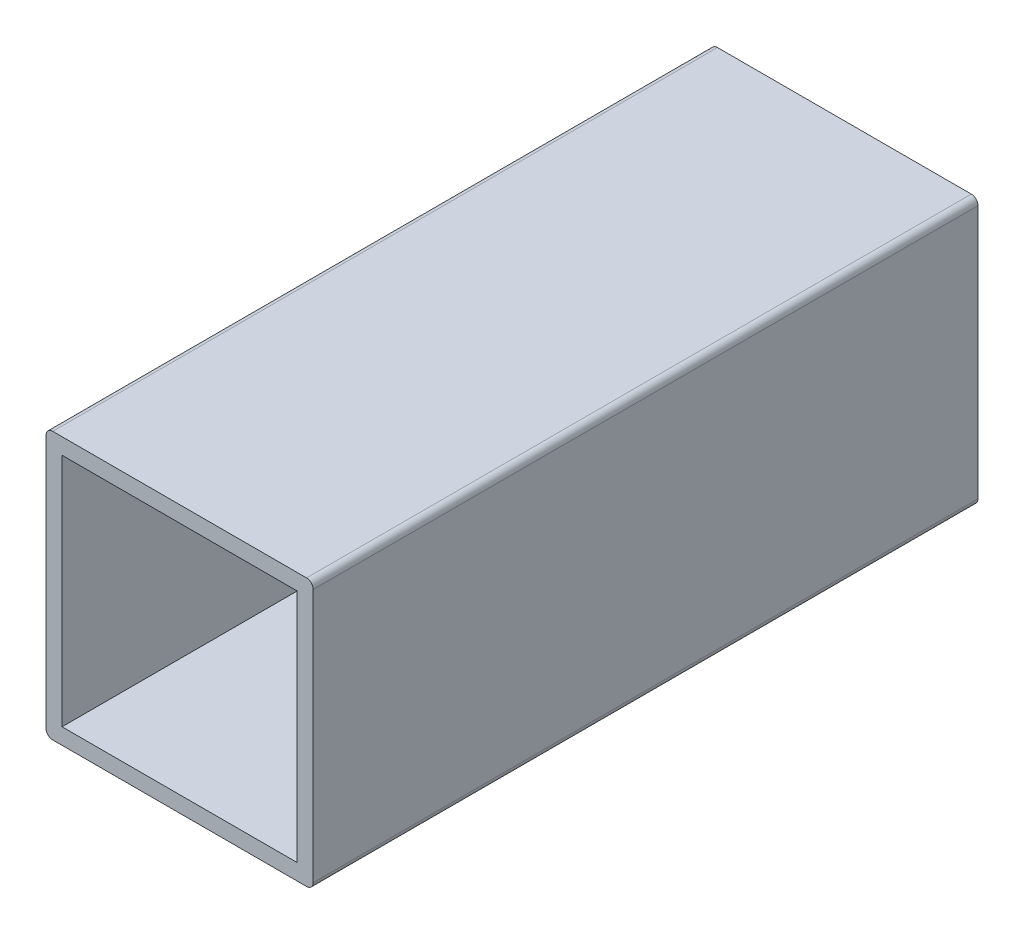
from build123d import *

# Parameters (mm, degrees)
ESBO_O1_W                = 70.4
ESBO_O1_H                = 70.4
RESSALTO_EXTRUS_O1_DEPTH = 99.5


with BuildPart() as part:
    # Esboço1 → Ressalto-extrusão1 (new, symmetric)
    with BuildSketch(Plane.XY):
        with BuildLine():
            Line((-38, -40), (38, -40))
            ThreePointArc((38, -40), (39.414213562, -39.414213562), (40, -38))
            Line((40, -38), (40, 38))
            ThreePointArc((40, 38), (39.414213562, 39.414213562), (38, 40))
            Line((38, 40), (-38, 40))
            ThreePointArc((-38, 40), (-39.414213562, 39.414213562), (-40, 38))
            Line((-40, 38), (-40, -38))
            ThreePointArc((-40, -38), (-39.414213562, -39.414213562), (-38, -40))
        make_face()
        Rectangle(ESBO_O1_W, ESBO_O1_H, mode=Mode.SUBTRACT)
    extrude(amount=RESSALTO_EXTRUS_O1_DEPTH, both=True)


solid = part.part
